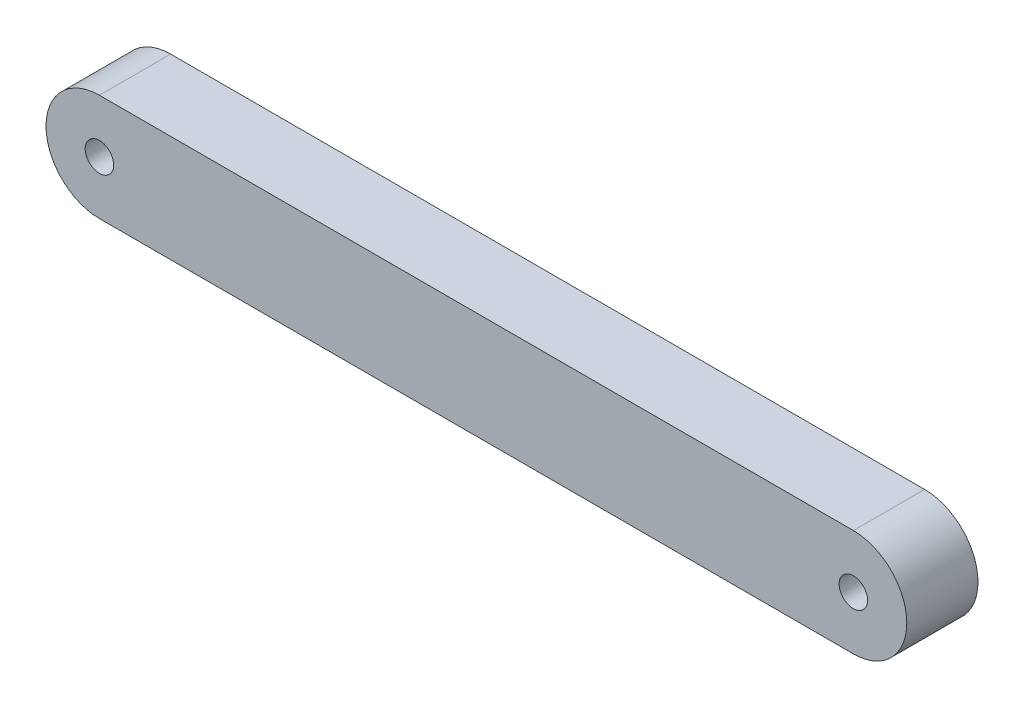
from build123d import *

# Parameters (mm, degrees)
SKETCH_1_R      = 4
EXTRUDE_1_DEPTH = 20


with BuildPart() as part:
    # 草图1 → 凸台-拉伸1 (new body)
    with BuildSketch(Plane.XY):
        with BuildLine():
            Line((0, 15), (211.7, 15))
            ThreePointArc((211.7, 15), (226.7, 0), (211.7, -15))
            Line((211.7, -15), (0, -15))
            ThreePointArc((0, -15), (-15, 0), (0, 15))
        make_face()
        Circle(SKETCH_1_R, mode=Mode.SUBTRACT)
        with Locations((211.7, 0)):
            Circle(SKETCH_1_R, mode=Mode.SUBTRACT)
    extrude(amount=EXTRUDE_1_DEPTH)


solid = part.part
